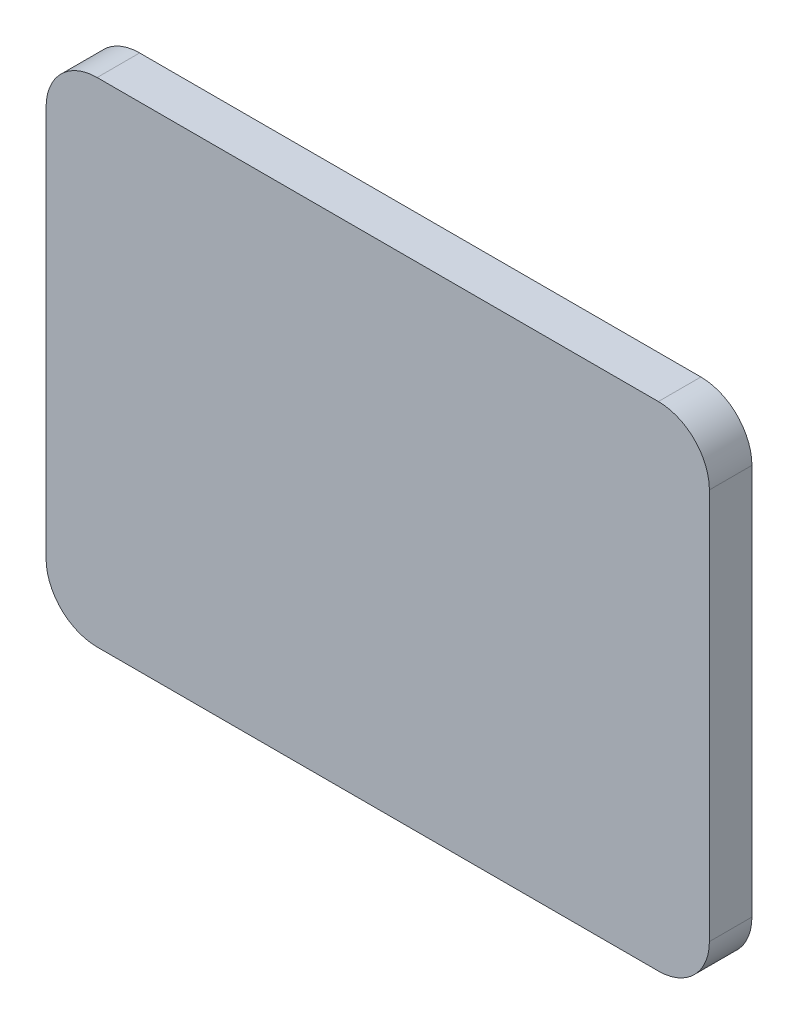
from build123d import *

# Parameters (mm, degrees)
SKETCH2_W           = 99.06
SKETCH2_H           = 73.66
BOSS_EXTRUDE1_DEPTH = 6.35
FILLET1_R           = 7.62


with BuildPart() as part:
    # Sketch2 → Boss-Extrude1 (new body)
    with BuildSketch(Plane.XY):
        Rectangle(SKETCH2_W, SKETCH2_H)
    extrude(amount=BOSS_EXTRUDE1_DEPTH)

    # Fillet1
    fillet1_edges = [part.edges().sort_by_distance(p)[0] for p in [
        (49.53, -36.83, 3.175),
        (-49.53, -36.83, 3.175),
        (-49.53, 36.83, 3.175),
        (49.53, 36.83, 3.175),
    ]]
    fillet(fillet1_edges, radius=FILLET1_R)


solid = part.part
